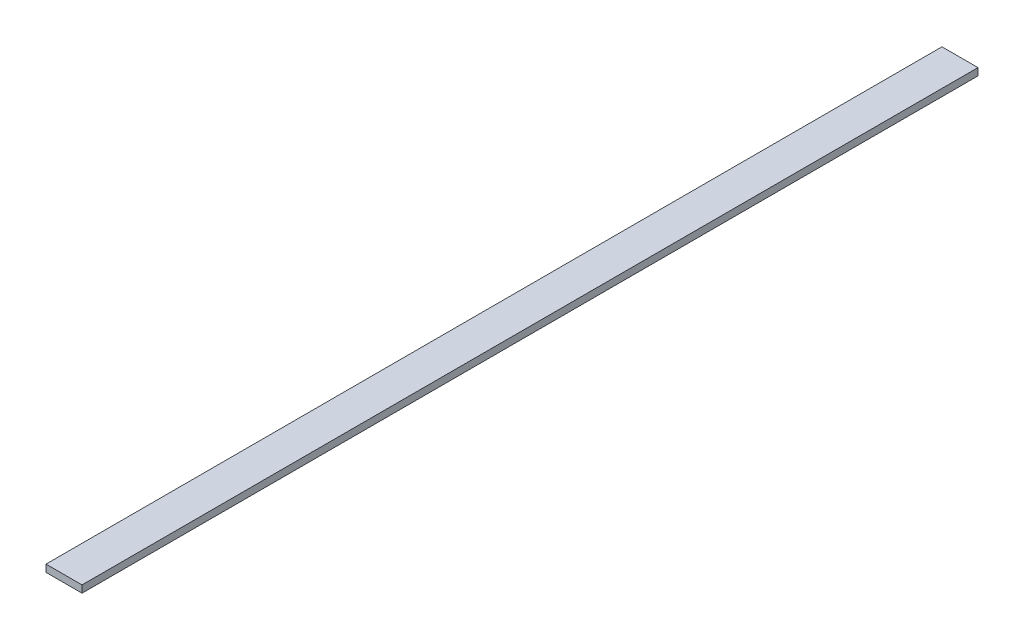
from build123d import *

# Parameters (mm, degrees)
SKETCH1_W           = 12.5
SKETCH1_H           = 2.5
BOSS_EXTRUDE1_DEPTH = 311


with BuildPart() as part:
    # Sketch1 → Boss-Extrude1 (new body)
    with BuildSketch(Plane.XY):
        with Locations((6.25, 1.25)):
            Rectangle(SKETCH1_W, SKETCH1_H)
    extrude(amount=BOSS_EXTRUDE1_DEPTH)


solid = part.part
